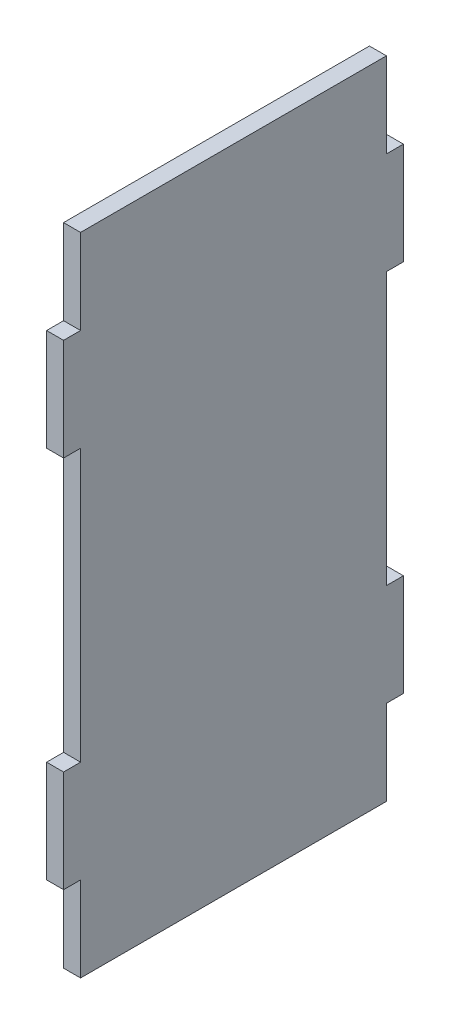
from build123d import *

# Parameters (mm, degrees)
BOSS_EXTRUDE1_DEPTH = 3.175


with BuildPart() as part:
    # Sketch1 → Boss-Extrude1 (new body)
    with BuildSketch(Plane(origin=(0, 0, 0), x_dir=(0, 0, -1), z_dir=(1, 0, 0))):
        Polygon((0, 0), (57.15, 0), (57.15, 15.875), (60.325, 15.875), (60.325, 34.925), (57.15, 34.925), (57.15, 85.725), (60.325, 85.725), (60.325, 104.775), (57.15, 104.775), (57.15, 120.65), (0, 120.65), (0, 104.775), (-3.175, 104.775), (-3.175, 85.725), (0, 85.725), (0, 34.925), (-3.175, 34.925), (-3.175, 15.875), (0, 15.875), align=None)
    extrude(amount=BOSS_EXTRUDE1_DEPTH)


solid = part.part
